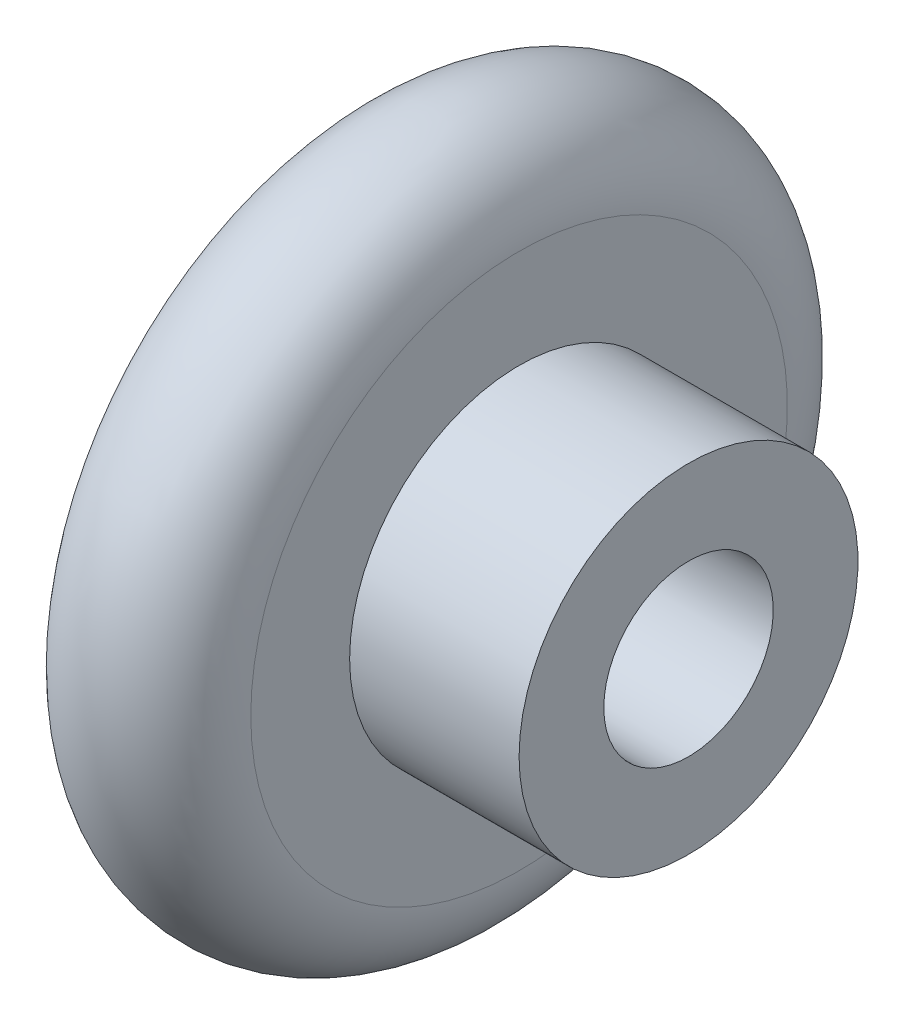
from build123d import *


with BuildPart() as part:
    # Эскиз1 → Повернуть1 (revolve)
    with BuildSketch(Plane.XY, mode=Mode.PRIVATE) as revolve_1_sk:
        with BuildLine():
            Line((0, 3), (12, 3))
            Line((12, 3), (12, 6))
            Line((12, 6), (6, 6))
            Line((6, 6), (6, 9.5))
            ThreePointArc((6, 9.5), (3, 12.5), (0, 9.5))
            Line((0, 9.5), (0, 3))
        make_face()
    revolve(revolve_1_sk.sketch.rotate(Axis((0, 0, 0), (1, 0, 0)), 90), axis=Axis((0, 0, 0), (1, 0, 0)))


solid = part.part
